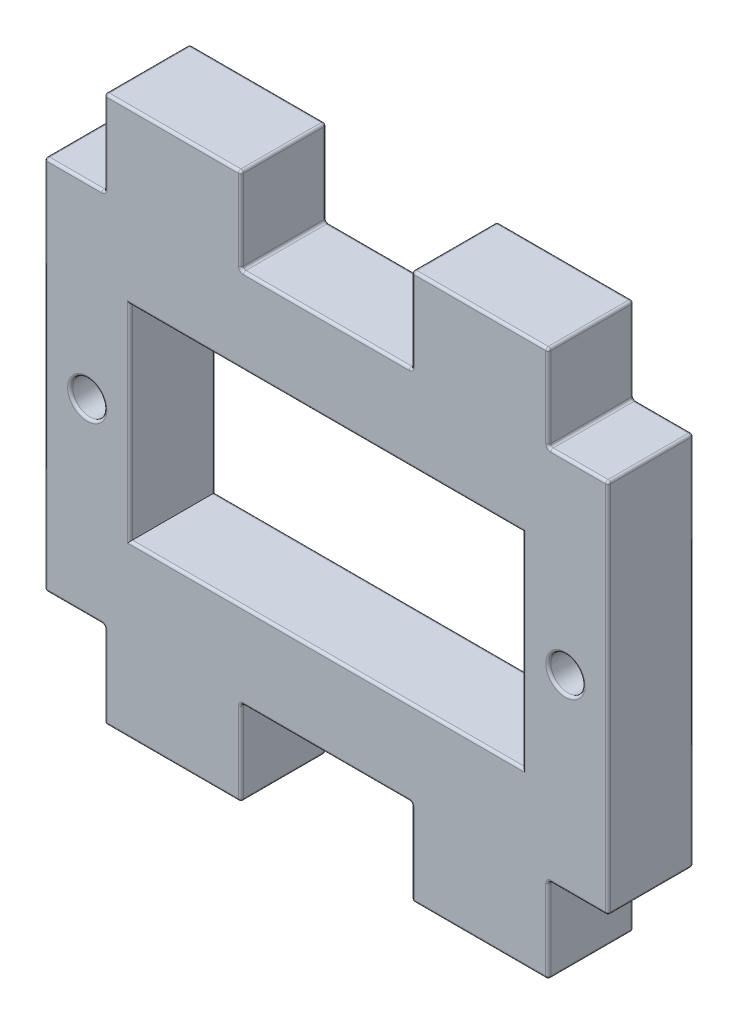
from build123d import *

# Parameters (mm, degrees)
SKETCH1_R           = 1
SKETCH1_W           = 23
SKETCH1_H           = 12
BOSS_EXTRUDE1_DEPTH = 2.5
FILLET1_R           = 0.15
FILLET2_R           = 0.15


with BuildPart() as part:
    # Sketch1 → Boss-Extrude1 (new, symmetric)
    with BuildSketch(Plane.XY):
        Polygon((16.5, -11), (16.5, 11), (13, 11), (13, 16), (5, 16), (5, 11), (-5, 11), (-5, 16), (-13, 16), (-13, 11), (-16.5, 11), (-16.5, -11), (-13, -11), (-13, -16), (-5, -16), (-5, -11), (5, -11), (5, -16), (13, -16), (13, -11), align=None)
        with Locations((-14, 0)):
            Circle(SKETCH1_R, mode=Mode.SUBTRACT)
        with Locations((14, 0)):
            Circle(SKETCH1_R, mode=Mode.SUBTRACT)
        Rectangle(SKETCH1_W, SKETCH1_H, mode=Mode.SUBTRACT)
    extrude(amount=BOSS_EXTRUDE1_DEPTH, both=True)

    # Fillet1
    fillet1_edges = [part.edges().sort_by_distance(p)[0] for p in [
        (-13, -16, 0),
        (-13, -13.5, -2.5),
        (-9, -16, -2.5),
        (-13, -13.5, 2.5),
        (-13, -11, 0),
        (-5, -16, 0),
        (-9, -16, 2.5),
        (-14.75, -11, -2.5),
        (-5, -13.5, -2.5),
        (-14.75, -11, 2.5),
        (-16.5, -11, 0),
        (-5, -13.5, 2.5),
        (-5, -11, 0),
        (-16.5, 0, -2.5),
        (0, -11, -2.5),
        (-16.5, 0, 2.5),
        (-16.5, 11, 0),
        (0, -11, 2.5),
        (5, -11, 0),
        (-14.75, 11, -2.5),
        (5, -13.5, -2.5),
        (-14.75, 11, 2.5),
        (-13, 11, 0),
        (5, -16, 0),
        (5, -13.5, 2.5),
        (-13, 13.5, -2.5),
        (9, -16, -2.5),
        (-13, 13.5, 2.5),
        (-13, 16, 0),
        (9, -16, 2.5),
        (13, -16, 0),
        (-9, 16, -2.5),
        (13, -13.5, -2.5),
        (-9, 16, 2.5),
        (-5, 16, 0),
        (13, -13.5, 2.5),
        (13, -11, 0),
        (-5, 13.5, -2.5),
        (14.75, -11, -2.5),
        (-5, 13.5, 2.5),
        (-5, 11, 0),
        (14.75, -11, 2.5),
        (16.5, -11, 0),
        (0, 11, -2.5),
        (16.5, 0, -2.5),
        (0, 11, 2.5),
        (5, 11, 0),
        (16.5, 11, 0),
        (16.5, 0, 2.5),
        (5, 13.5, -2.5),
        (14.75, 11, -2.5),
        (5, 13.5, 2.5),
        (5, 16, 0),
        (13, 11, 0),
        (14.75, 11, 2.5),
        (9, 16, -2.5),
        (13, 13.5, -2.5),
        (9, 16, 2.5),
        (13, 13.5, 2.5),
        (13, 16, 0),
    ]]
    fillet(fillet1_edges, radius=FILLET1_R)

    # Fillet2
    fillet2_edges = [part.edges().sort_by_distance(p)[0] for p in [
        (-11.5, 0, -2.5),
        (0, 6, -2.5),
        (11.5, 0, -2.5),
        (0, -6, -2.5),
        (-15, 0, -2.5),
        (13, 0, -2.5),
        (13, 0, 2.5),
        (-15, 0, 2.5),
        (11.5, 0, 2.5),
        (0, 6, 2.5),
        (-11.5, 0, 2.5),
        (0, -6, 2.5),
    ]]
    fillet(fillet2_edges, radius=FILLET2_R)


solid = part.part
